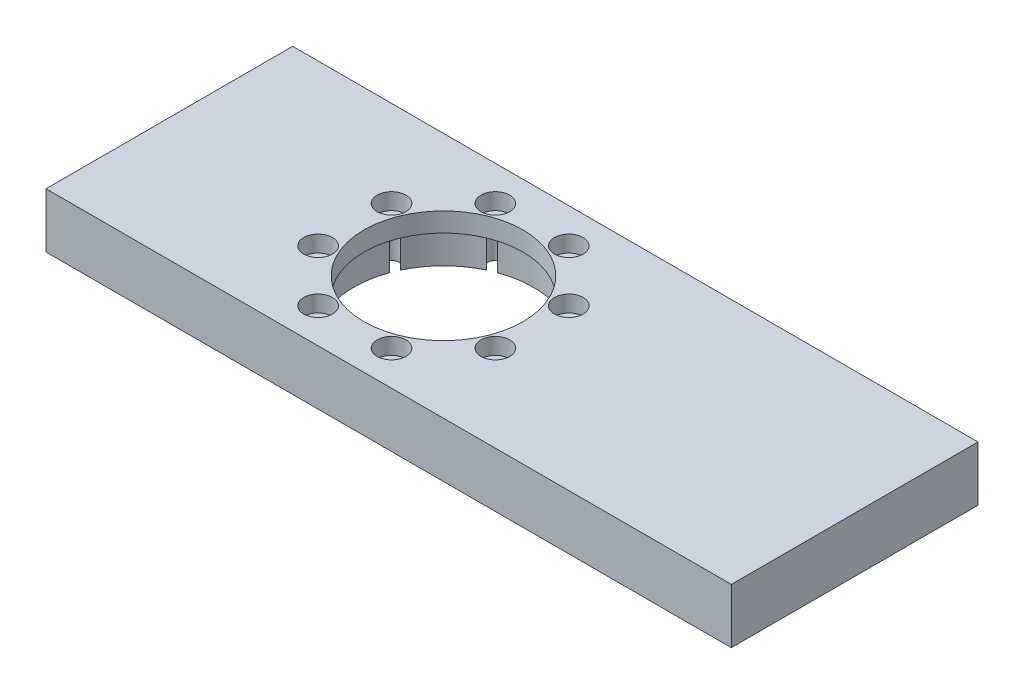
from build123d import *

# Parameters (mm, degrees)
SKETCH1_W                               = 250
SKETCH1_H                               = 90
BOSS_EXTRUDE1_DEPTH                     = 20
CUT_EXTRUDE1_DEPTH                      = 158.876534038
CUT_EXTRUDE1_DEPTH_BACK                 = 158.876534038
SKETCH11_R                              = 29
CBORE_FOR_M5_HEX_HEAD_BOLT2_D           = 5.5
CBORE_FOR_M5_HEX_HEAD_BOLT2_CBORE_D     = 10.5
CBORE_FOR_M5_HEX_HEAD_BOLT2_CBORE_DEPTH = 6
SKETCH15_R                              = 32.75
CUT_EXTRUDE2_DEPTH                      = 13


with BuildPart() as part:
    # Sketch1 → Boss-Extrude1 (new body)
    with BuildSketch(Plane(origin=(0, 0, 0), x_dir=(1, 0, 0), z_dir=(0, 1, 0))):
        with Locations((25, 0)):
            Rectangle(SKETCH1_W, SKETCH1_H)
    extrude(amount=BOSS_EXTRUDE1_DEPTH)

    # Sketch11 → Cut-Extrude1 (cut, two sides: drawn at the far end of the back side and taken through both)
    with BuildSketch(Plane(origin=(0, 20, 0), x_dir=(1, 0, 0), z_dir=(0, 1, 0)).offset(-CUT_EXTRUDE1_DEPTH_BACK)):
        with Locations(Location((0, 0, 0), (0, 0, 270))):
            Circle(SKETCH11_R)
    extrude(amount=CUT_EXTRUDE1_DEPTH + CUT_EXTRUDE1_DEPTH_BACK, mode=Mode.SUBTRACT)

    # CBORE for M5 Hex Head Bolt2 (through all)
    with Locations(Plane(origin=(-32.335783638, 20, -13.393920133), x_dir=(0, 0, 1), z_dir=(0, 1, 0))):
        with Locations((0, 0), (-18.941863505, 18.941863505), (-18.941863505, 45.729703771), (0, 64.671567276), (26.787840266, 64.671567276), (45.729703771, 45.729703771), (45.729703771, 18.941863505), (26.787840266, 0)):
            CounterBoreHole(CBORE_FOR_M5_HEX_HEAD_BOLT2_D / 2, CBORE_FOR_M5_HEX_HEAD_BOLT2_CBORE_D / 2, CBORE_FOR_M5_HEX_HEAD_BOLT2_CBORE_DEPTH)

    # Sketch15 → Cut-Extrude2 (cut)
    with BuildSketch(Plane(origin=(0, 0, 0), x_dir=(1, 0, 0), z_dir=(0, 1, 0))):
        Circle(SKETCH15_R)
    extrude(amount=CUT_EXTRUDE2_DEPTH, mode=Mode.SUBTRACT)


solid = part.part
